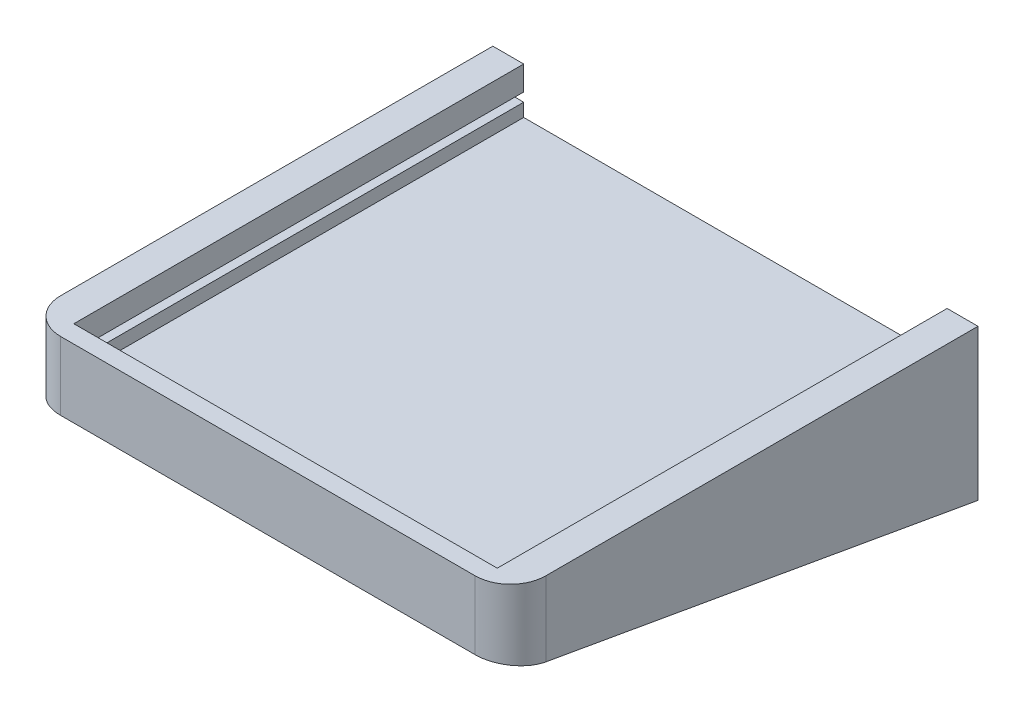
from build123d import *

# Parameters (mm, degrees)
ESQUISSE2_W             = 110
ESQUISSE2_H             = 106
BOSS_EXTRU_3_DEPTH      = 5
BOSS_EXTRU_4_DEPTH      = 3
BOSS_EXTRU_5_DEPTH      = 2
BOSS_EXTRU_6_DEPTH      = 5.5
BOSS_EXTRU_7_DEPTH      = 110
ESQUISSE7_R             = 2.35
ENL_V_MAT_EXTRU_1_DEPTH = 12
CONG_3_R                = 8
ENL_V_MAT_EXTRU_2_DEPTH = 4
CHANFREIN1_SIZE         = 0.5


with BuildPart() as part:
    # Esquisse2 → Boss.-Extru.3 (new body)
    with BuildSketch(Plane(origin=(0, 0, 0), x_dir=(1, 0, 0), z_dir=(0, 1, 0))):
        with Locations((55, 53)):
            Rectangle(ESQUISSE2_W, ESQUISSE2_H)
    extrude(amount=BOSS_EXTRU_3_DEPTH)

    # Esquisse3 → Boss.-Extru.4 (add)
    with BuildSketch(Plane(origin=(0, 5, 0), x_dir=(1, 0, 0), z_dir=(0, 1, 0))):
        Polygon((7, 4), (7, 106), (0, 106), (0, 0), (110, 0), (110, 106), (103, 106), (103, 4), align=None)
    extrude(amount=BOSS_EXTRU_4_DEPTH)

    # Esquisse4 → Boss.-Extru.5 (add)
    with BuildSketch(Plane(origin=(0, 8, 0), x_dir=(1, 0, 0), z_dir=(0, 1, 0))):
        Polygon((4, 106), (4, 4), (106, 4), (106, 106), (110, 106), (110, 0), (0, 0), (0, 106), align=None)
    extrude(amount=BOSS_EXTRU_5_DEPTH)

    # Esquisse6 → Boss.-Extru.6 (add)
    with BuildSketch(Plane(origin=(0, 10, 0), x_dir=(1, 0, 0), z_dir=(0, 1, 0))):
        Polygon((0, 106), (7, 106), (7, 4), (103, 4), (103, 106), (110, 106), (110, 4), (110, 0), (0, 0), (0, 4), align=None)
    extrude(amount=BOSS_EXTRU_6_DEPTH)

    # Esquisse8 → Boss.-Extru.7 (add)
    with BuildSketch(Plane(origin=(110, 0, 0), x_dir=(0, 0, -1), z_dir=(1, 0, 0))):
        Polygon((0, 0), (106, 0), (106, -18.690659955), align=None)
    extrude(amount=-BOSS_EXTRU_7_DEPTH)

    # Esquisse7 → Enlèv. mat.-Extru.1 (cut)
    with BuildSketch(Plane(origin=(0, 0, -106), x_dir=(-1, 0, 0), z_dir=(0, 0, -1))):
        with Locations((-103, 0)):
            Circle(ESQUISSE7_R)
        with Locations((-7, 0)):
            Circle(ESQUISSE7_R)
    extrude(amount=-ENL_V_MAT_EXTRU_1_DEPTH, mode=Mode.SUBTRACT)

    # Congé3
    cong_3_edges = [part.edges().sort_by_distance(p)[0] for p in [
        (110, 7.75, 0),
        (0, 7.75, 0),
    ]]
    fillet(cong_3_edges, radius=CONG_3_R)

    # Esquisse9 → Enlèv. mat.-Extru.2 (cut)
    with BuildSketch(Plane(origin=(0, 0, 0), x_dir=(1, 0, 0), z_dir=(0, -0.9848077530122092, 0.17364817766692348))):
        with BuildLine():
            Line((14, -8), (96, -8))
            ThreePointArc((96, -8), (100.242640687, -9.757359313), (102, -14))
            Line((102, -14), (102, -97.63522086))
            ThreePointArc((102, -97.63522086), (100.242640687, -101.877861547), (96, -103.63522086))
            Line((96, -103.63522086), (14, -103.63522086))
            ThreePointArc((14, -103.63522086), (9.757359313, -101.877861547), (8, -97.63522086))
            Line((8, -97.63522086), (8, -14))
            ThreePointArc((8, -14), (9.757359313, -9.757359313), (14, -8))
        make_face()
    extrude(amount=-ENL_V_MAT_EXTRU_2_DEPTH, mode=Mode.SUBTRACT)

    # Chanfrein1
    chanfrein1_edges = [part.edges().sort_by_distance(p)[0] for p in [
        (105.35, 0, -106),
        (9.35, 0, -106),
    ]]
    chamfer(chanfrein1_edges, length=CHANFREIN1_SIZE)


solid = part.part
